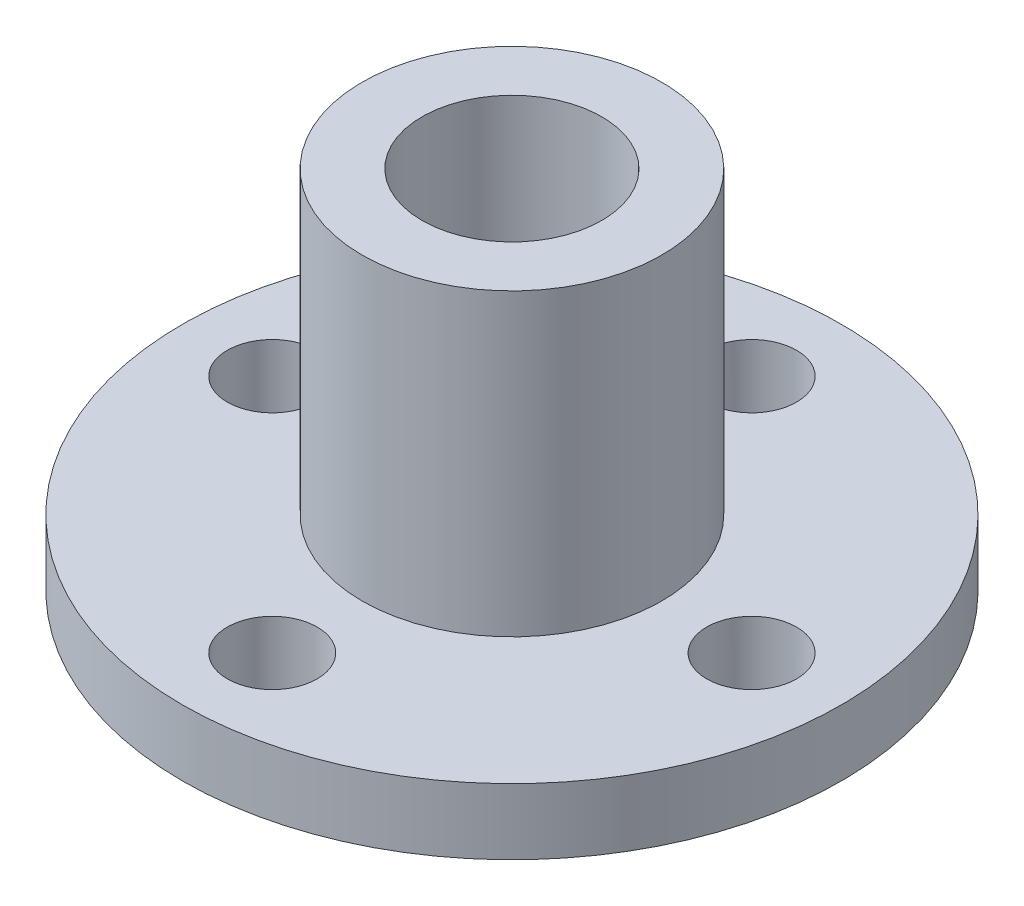
from build123d import *

# Parameters (mm, degrees)
SKETCH_1_R               = 11
EXTRUDE_1_DEPTH          = 2.2
SKETCH_2_R               = 5
EXTRUDE_2_DEPTH          = 10
SKETCH_3_R               = 3
CUT_EXTRUDE_1_DEPTH      = 15
SKETCH_4_R               = 1.5
CUT_EXTRUDE_2_DEPTH      = 15
SKETCH_5_R               = 1.5
CUT_EXTRUDE_3_DEPTH      = 15
PATTERN_CIRCULAR_1_COUNT = 4


with BuildPart() as part:
    # 草图1 → 凸台-拉伸1 (new body)
    with BuildSketch(Plane(origin=(0, 0, 0), x_dir=(1, 0, 0), z_dir=(0, 1, 0))):
        Circle(SKETCH_1_R)
    extrude(amount=EXTRUDE_1_DEPTH)

    # 草图2 → 凸台-拉伸2 (add)
    with BuildSketch(Plane(origin=(0, 2.2, 0), x_dir=(1, 0, 0), z_dir=(0, 1, 0))):
        Circle(SKETCH_2_R)
    extrude(amount=EXTRUDE_2_DEPTH)

    # 草图3 → 切除-拉伸1 (cut)
    with BuildSketch(Plane(origin=(0, 12.2, 0), x_dir=(1, 0, 0), z_dir=(0, 1, 0))):
        Circle(SKETCH_3_R)
    extrude(amount=-CUT_EXTRUDE_1_DEPTH, mode=Mode.SUBTRACT)

    # 草图4 → 切除-拉伸2 (cut)
    with BuildSketch(Plane.XY):
        with Locations((0, 7.2)):
            Circle(SKETCH_4_R)
    extrude(amount=-CUT_EXTRUDE_2_DEPTH, mode=Mode.SUBTRACT)

    # 草图5 → 切除-拉伸3 (cut)
    with BuildSketch(Plane(origin=(0, 2.2, 0), x_dir=(1, 0, 0), z_dir=(0, 1, 0))):
        with Locations((-8, 0)):
            Circle(SKETCH_5_R)
    cut_extrude_3 = extrude(amount=-CUT_EXTRUDE_3_DEPTH, mode=Mode.SUBTRACT)

    # 阵列(圆周)1: 切除-拉伸3 ×4 about axis
    pattern_circular_1_axis = Axis((0, 12.2, 0), (0, -1, 0))
    for i in range(1, PATTERN_CIRCULAR_1_COUNT):
        add(cut_extrude_3.rotate(pattern_circular_1_axis, i * 360 / PATTERN_CIRCULAR_1_COUNT), mode=Mode.SUBTRACT)


solid = part.part
